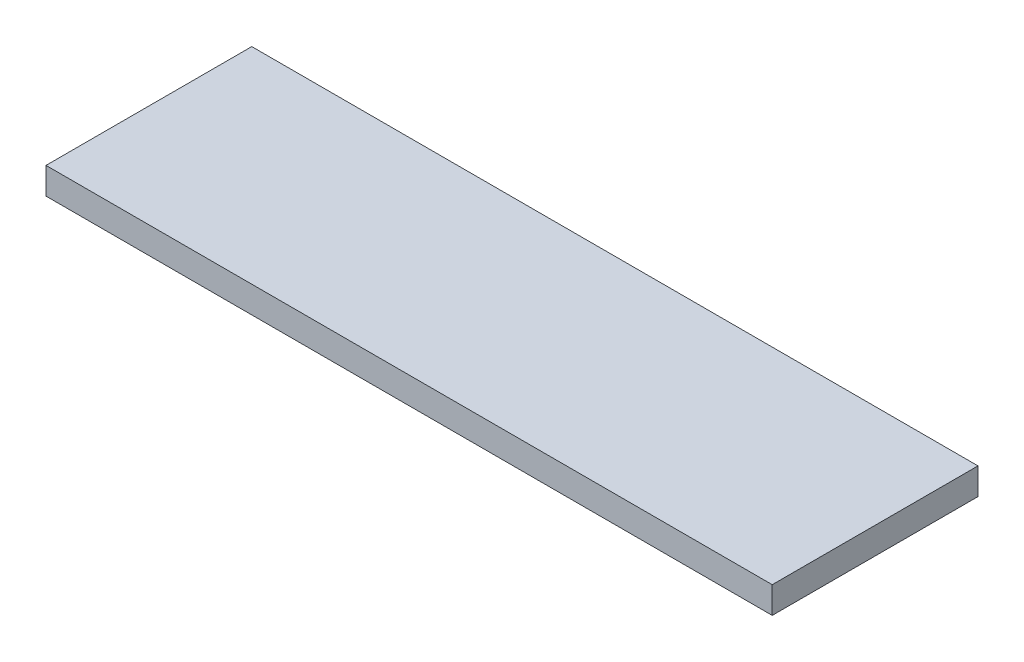
from build123d import *

# Parameters (mm, degrees)
CROQUIS1_W              = 600
CROQUIS1_H              = 170
SALIENTE_EXTRUIR1_DEPTH = 22


with BuildPart() as part:
    # Croquis1 → Saliente-Extruir1 (new body)
    with BuildSketch(Plane(origin=(0, 0, 0), x_dir=(1, 0, 0), z_dir=(0, 1, 0))):
        with Locations((53.101663372, 28.954400701)):
            Rectangle(CROQUIS1_W, CROQUIS1_H)
    extrude(amount=SALIENTE_EXTRUIR1_DEPTH)


solid = part.part
